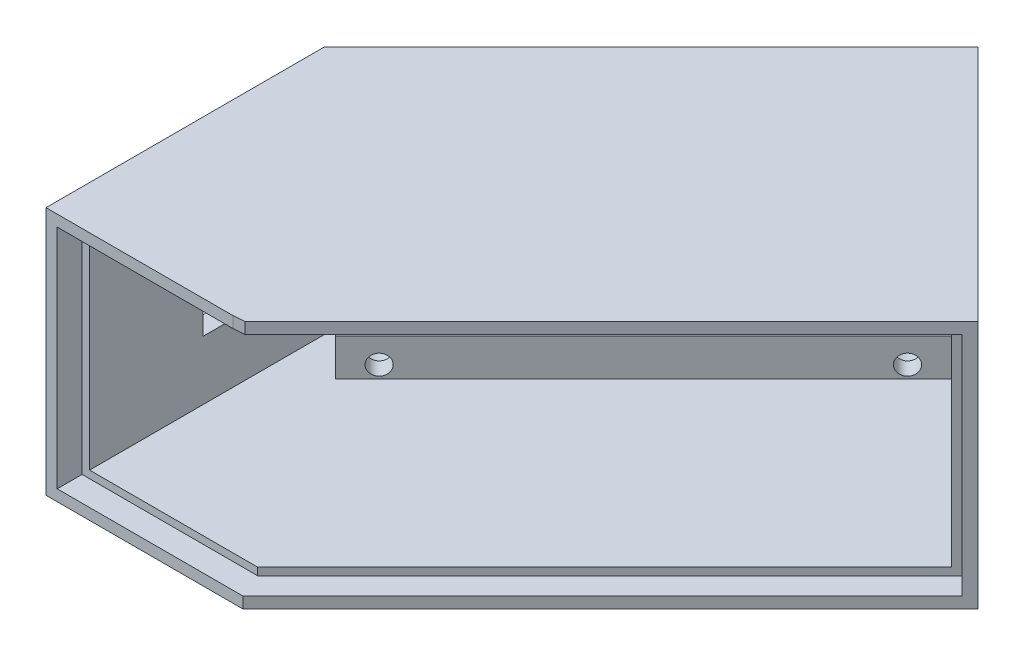
from build123d import *

# Parameters (mm, degrees)
BOSS_EXTRUDE1_DEPTH = 40
SHELL1_T            = -3
BOSS_EXTRUDE2_DEPTH = 4
BOSS_EXTRUDE3_DEPTH = 4
BOSS_EXTRUDE4_DEPTH = 1.8
BOSS_EXTRUDE5_DEPTH = 1.8
SKETCH10_R          = 1.6
CUT_EXTRUDE6_DEPTH  = 107.30423742
SKETCH11_W          = 12.8
SKETCH11_H          = 15
CUT_EXTRUDE7_DEPTH  = 3
BOSS_EXTRUDE7_START = 10
SKETCH12_W          = 69.967359313
SKETCH12_H          = 34
SKETCH12_R          = 1.6
BOSS_EXTRUDE7_DEPTH = 10
SKETCH13_R          = 3.1
CUT_EXTRUDE9_DEPTH  = 10
SKETCH14_W          = 69.967359313
SKETCH14_H          = 22
CUT_EXTRUDE10_DEPTH = 10


with BuildPart() as part:
    # Sketch1 → Boss-Extrude1 (new body)
    with BuildSketch(Plane(origin=(0, 0, 0), x_dir=(1, 0, 0), z_dir=(0, 1, 0))):
        Polygon((-43.359374855, -5.394325428), (-43.359374855, 35.316352691), (9.115019377, 87.790746923), (44.470358437, 52.435407864), (-13.359374855, -5.394325428), align=None)
    extrude(amount=BOSS_EXTRUDE1_DEPTH)

    # Shell1
    shell1_openings = [part.faces().sort_by_distance(p)[0] for p in [
        (15.555491791, 20, -23.520541218),
        (-28.359374855, 20, 5.394325428),
    ]]
    offset(amount=SHELL1_T, openings=shell1_openings, kind=Kind.INTERSECTION)

    # Sketch6 → Boss-Extrude2 (add)
    with BuildSketch(Plane(origin=(-3.982524714, 0, -3.982524714), x_dir=(0.7071067811865489, 0, -0.7071067811865462), z_dir=(0.7071067811865462, 0, 0.7071067811865489))):
        Polygon((-13.260868642, 38.2), (66.722724487, 38.2), (66.722724487, 1.8), (-13.260868642, 1.8), (-13.260868642, 0), (68.522724487, 0), (68.522724487, 40), (-13.260868642, 40), align=None)
    extrude(amount=BOSS_EXTRUDE2_DEPTH)

    # Sketch7 → Boss-Extrude3 (add)
    with BuildSketch(Plane.XY.offset(5.394325428)):
        Polygon((-13.359374855, 1.8), (-41.559374855, 1.8), (-41.559374855, 38.2), (-13.359374855, 38.2), (-13.359374855, 40), (-43.359374855, 40), (-43.359374855, 0), (-13.359374855, 0), align=None)
    extrude(amount=BOSS_EXTRUDE3_DEPTH)

    # Sketch8 → Boss-Extrude4 (add)
    with BuildSketch(Plane.XZ):
        Polygon((-13.359374855, 9.394325428), (-11.702520605, 9.394325428), (-10.53094773, 8.222752552), (-13.359374855, 5.394325428), align=None)
    extrude(amount=-BOSS_EXTRUDE4_DEPTH)

    # Sketch9 → Boss-Extrude5 (add)
    with BuildSketch(Plane(origin=(0, 40, 0), x_dir=(1, 0, 0), z_dir=(0, 1, 0))):
        Polygon((-13.359374855, -5.394325428), (-10.53094773, -8.222752552), (-11.553745116, -9.245549939), (-13.359374855, -9.394325428), align=None)
    extrude(amount=-BOSS_EXTRUDE5_DEPTH)

    # Sketch10 → Cut-Extrude6 (cut, through all)
    with BuildSketch(Plane(origin=(-37.216543429, 0, -37.216543429), x_dir=(0.7071067811865488, 0, -0.7071067811865464), z_dir=(0.7071067811865464, 0, 0.7071067811865488))):
        with Locations((60.522724487, 35)):
            Circle(SKETCH10_R)
        with Locations((60.522724487, 5)):
            Circle(SKETCH10_R)
        with Locations((0.522724487, 35)):
            Circle(SKETCH10_R)
        with Locations((0.522724487, 5)):
            Circle(SKETCH10_R)
    extrude(amount=-CUT_EXTRUDE6_DEPTH, mode=Mode.SUBTRACT)

    # Sketch11 → Cut-Extrude7 (cut)
    with BuildSketch(Plane(origin=(-40.359374855, 0, 0), x_dir=(0, 0, -1), z_dir=(1, 0, 0))):
        with Locations((19.207640819, 20)):
            Rectangle(SKETCH11_W, SKETCH11_H)
    extrude(amount=-CUT_EXTRUDE7_DEPTH, mode=Mode.SUBTRACT)

    # Sketch12 → Boss-Extrude7 (add)
    with BuildSketch(Plane(origin=(-37.216543429, 0, -37.216543429), x_dir=(0.7071067811865488, 0, -0.7071067811865464), z_dir=(0.7071067811865464, 0, 0.7071067811865488)).offset(BOSS_EXTRUDE7_START)):
        with Locations((30.539044831, 20)):
            Rectangle(SKETCH12_W, SKETCH12_H)
        with Locations((0.522724487, 35)):
            Circle(SKETCH12_R, mode=Mode.SUBTRACT)
        with Locations((60.522724487, 35)):
            Circle(SKETCH12_R, mode=Mode.SUBTRACT)
        with Locations((60.522724487, 5)):
            Circle(SKETCH12_R, mode=Mode.SUBTRACT)
        with Locations((0.522724487, 5)):
            Circle(SKETCH12_R, mode=Mode.SUBTRACT)
    extrude(amount=-BOSS_EXTRUDE7_DEPTH)

    # Sketch13 → Cut-Extrude9 (cut)
    with BuildSketch(Plane(origin=(-39.337863773, 0, -39.337863773), x_dir=(-0.7071067811865488, 0, 0.7071067811865464), z_dir=(-0.7071067811865464, 0, -0.7071067811865488))):
        with Locations((-0.522724487, 35)):
            Circle(SKETCH13_R)
        with Locations((-0.522724487, 5)):
            Circle(SKETCH13_R)
        with Locations((-60.522724487, 5)):
            Circle(SKETCH13_R)
        with Locations((-60.522724487, 35)):
            Circle(SKETCH13_R)
    extrude(amount=-CUT_EXTRUDE9_DEPTH, mode=Mode.SUBTRACT)

    # Sketch14 → Cut-Extrude10 (cut)
    with BuildSketch(Plane(origin=(-30.145475617, 0, -30.145475617), x_dir=(0.7071067811865488, 0, -0.7071067811865462), z_dir=(0.7071067811865462, 0, 0.7071067811865488))):
        with Locations((30.539044831, 20)):
            Rectangle(SKETCH14_W, SKETCH14_H)
    extrude(amount=-CUT_EXTRUDE10_DEPTH, mode=Mode.SUBTRACT)


solid = part.part
